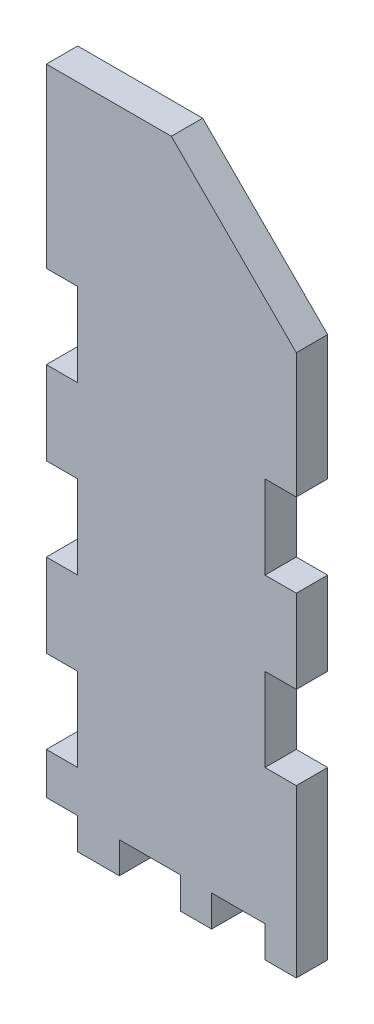
from build123d import *

# Parameters (mm, degrees)
BOSS_EXTRUDE1_DEPTH = 4.7752
SKETCH3_W           = 4.7752
SKETCH3_H           = 4.7752
SKETCH3_W_2         = 9.292163612
SKETCH3_W_3         = 8.132236388
CUT_EXTRUDE2_DEPTH  = 6.35
SKETCH6_W           = 4.7752
SKETCH6_H           = 12.7
CUT_EXTRUDE3_DEPTH  = 6.35


with BuildPart() as part:
    # Sketch2 → Boss-Extrude1 (new body)
    with BuildSketch(Plane.XY):
        Polygon((0, 0), (38.1, 0), (38.1, 82.55), (19.05, 101.6), (0, 101.6), align=None)
    extrude(amount=BOSS_EXTRUDE1_DEPTH)

    # Sketch3 → Cut-Extrude2 (cut)
    with BuildSketch(Plane.XY.offset(4.7752)):
        with Locations((2.3876, 2.3876)):
            Rectangle(SKETCH3_W, SKETCH3_H)
        with Locations((15.771281806, 2.3876)):
            Rectangle(SKETCH3_W_2, SKETCH3_H)
        with Locations((29.258681806, 2.3876)):
            Rectangle(SKETCH3_W_3, SKETCH3_H)
    extrude(amount=-CUT_EXTRUDE2_DEPTH, mode=Mode.SUBTRACT)

    # Sketch6 → Cut-Extrude3 (cut)
    with BuildSketch(Plane.XY.offset(4.7752)):
        with Locations((2.3876, 17.4752)):
            Rectangle(SKETCH6_W, SKETCH6_H)
        with Locations((2.3876, 42.8752)):
            Rectangle(SKETCH6_W, SKETCH6_H)
        with Locations((2.3876, 68.2752)):
            Rectangle(SKETCH6_W, SKETCH6_H)
        with Locations((35.7124, 57.15)):
            Rectangle(SKETCH6_W, SKETCH6_H)
        with Locations((35.7124, 31.75)):
            Rectangle(SKETCH6_W, SKETCH6_H)
    extrude(amount=-CUT_EXTRUDE3_DEPTH, mode=Mode.SUBTRACT)


solid = part.part
